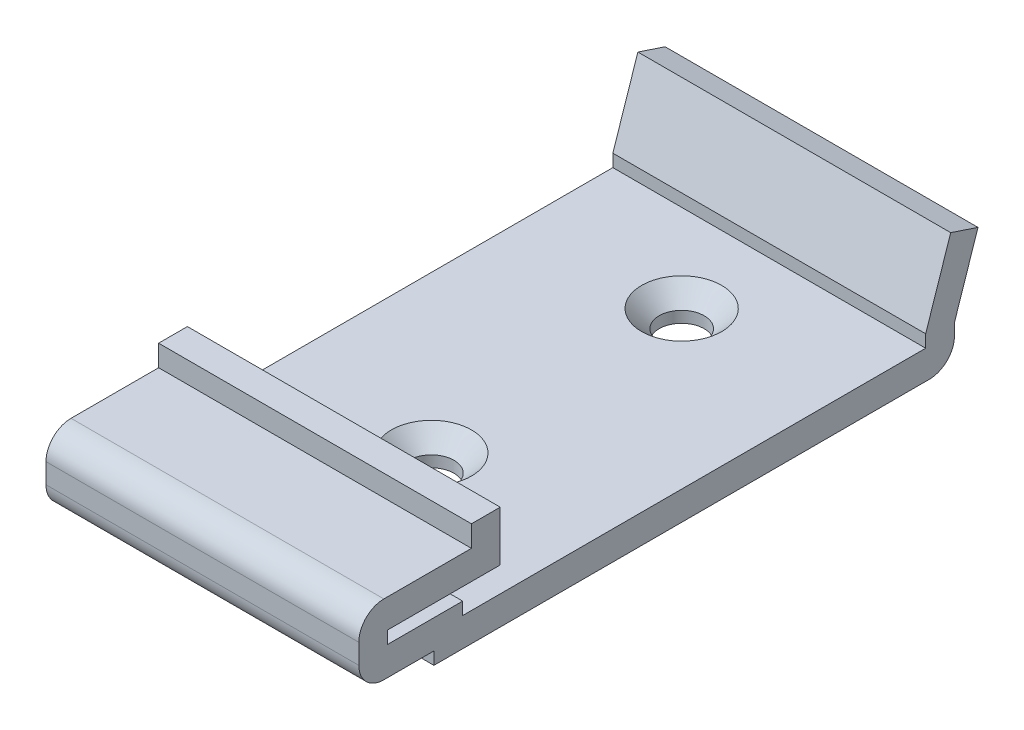
from build123d import *

# Parameters (mm, degrees)
EXTRUDE_1_DEPTH          = 5
FILLET_1_R               = 2
EXTRUDE_3_DEPTH          = 15
HOLE_WIZARD_1_AT_2_COUNT = 2
HOLE_WIZARD_1_AT_2_PITCH = 20


with BuildPart() as part:
    # 草图1 → 凸台-拉伸1 (new, symmetric)
    with BuildSketch(Plane(origin=(0, 0, 0), x_dir=(0, 0, -1), z_dir=(1, 0, 0))):
        Polygon((0, 4), (0, 0), (-9, 0), (-9, -1), (-3, -1), (-3, -2), (34, -2), (34, -1), (36, 5), (38.181971586, 4.272676138), (36.3, -1.373238618), (36.3, -4.3), (-5.3, -4.3), (-5.3, -3.3), (-11.3, -3.3), (-11.3, 2.3), (-2.3, 2.3), (-2.3, 4), align=None)
    extrude(amount=EXTRUDE_1_DEPTH, both=True)

    # 圆角1
    fillet_1_edges = [part.edges().sort_by_distance(p)[0] for p in [
        (0, -4.3, -36.3),
        (0, -3.3, 11.3),
        (0, 2.3, 11.3),
    ]]
    fillet(fillet_1_edges, radius=FILLET_1_R)

    # 草图7 → 凸台-拉伸3 (add)
    with BuildSketch(Plane(origin=(5, 0, 0), x_dir=(0, 0, -1), z_dir=(1, 0, 0))):
        with BuildLine():
            Line((-5.3, -4.3), (34.3, -4.3))
            ThreePointArc((34.3, -4.3), (35.714213562, -3.714213562), (36.3, -2.3))
            Line((36.3, -2.3), (36.3, -1.373238618))
            Line((36.3, -1.373238618), (38.181971586, 4.272676138))
            Line((38.181971586, 4.272676138), (36, 5))
            Line((36, 5), (34, -1))
            Line((34, -1), (34, -2))
            Line((34, -2), (-3, -2))
            Line((-3, -2), (-3, -1))
            Line((-3, -1), (-9, -1))
            Line((-9, -1), (-9, 0))
            Line((-9, 0), (0, 0))
            Line((0, 0), (0, 4))
            Line((0, 4), (-2.3, 4))
            Line((-2.3, 4), (-2.3, 2.3))
            Line((-2.3, 2.3), (-9.3, 2.3))
            ThreePointArc((-9.3, 2.3), (-10.714213562, 1.714213562), (-11.3, 0.3))
            Line((-11.3, 0.3), (-11.3, -1.3))
            ThreePointArc((-11.3, -1.3), (-10.714213562, -2.714213562), (-9.3, -3.3))
            Line((-9.3, -3.3), (-5.3, -3.3))
            Line((-5.3, -3.3), (-5.3, -4.3))
        make_face()
    extrude(amount=EXTRUDE_3_DEPTH)

    # 草图3 → 打孔尺寸开槽半沉头螺钉的类型1 (revolve, cut)
    with BuildSketch(Plane(origin=(7.5, -2, -27), x_dir=(0, 0, 1), z_dir=(1, 0, 0))):
        Polygon((0, 0), (0, 2.3), (1.8, 2.3), (1.8, 1.4), (3.2, 0), align=None)
    hole_wizard_1 = revolve(axis=Axis((7.5, 4.35, -27), (0, -1, 0)), mode=Mode.SUBTRACT)

    # 打孔尺寸开槽半沉头螺钉的类型1 at 2: 打孔尺寸开槽半沉头螺钉的类型1 ×2
    with Locations(*[(0, 0, i * HOLE_WIZARD_1_AT_2_PITCH) for i in range(1, HOLE_WIZARD_1_AT_2_COUNT)]):
        add(hole_wizard_1, mode=Mode.SUBTRACT)


solid = part.part
